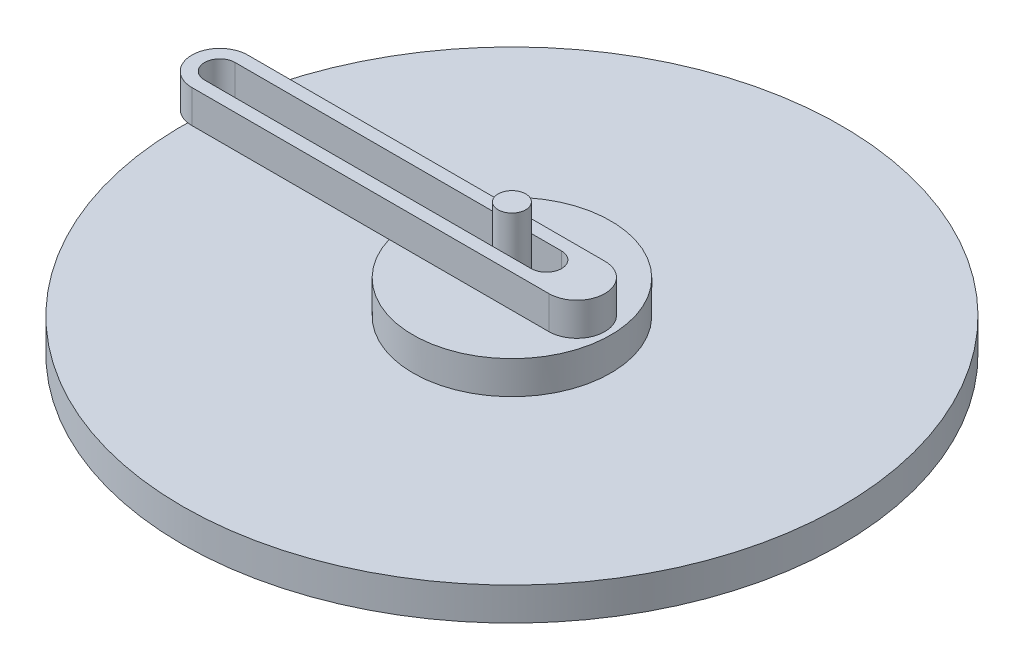
from build123d import *

# Parameters (mm, degrees)
SKETCH1_R           = 50
BOSS_EXTRUDE1_DEPTH = 5
SKETCH2_R           = 15
BOSS_EXTRUDE2_DEPTH = 5
BOSS_EXTRUDE3_DEPTH = 5
CUT_EXTRUDE1_DEPTH  = 5
SKETCH6_R           = 2.088892153
BOSS_EXTRUDE4_DEPTH = 10


with BuildPart() as part:
    # Sketch1 → Boss-Extrude1 (new body)
    with BuildSketch(Plane(origin=(0, 0, 0), x_dir=(1, 0, 0), z_dir=(0, 1, 0))):
        Circle(SKETCH1_R)
    extrude(amount=BOSS_EXTRUDE1_DEPTH)

    # Sketch2 → Boss-Extrude2 (add)
    with BuildSketch(Plane(origin=(0, 5, 0), x_dir=(1, 0, 0), z_dir=(0, 1, 0))):
        Circle(SKETCH2_R)
    extrude(amount=BOSS_EXTRUDE2_DEPTH)

    # Sketch4 → Boss-Extrude3 (add)
    with BuildSketch(Plane(origin=(0, 10, 0), x_dir=(1, 0, 0), z_dir=(0, 1, 0))):
        with BuildLine():
            Line((9.847634435, -4.252387597), (-44.314354955, -4.252387597))
            ThreePointArc((-44.314354955, -4.252387597), (-48.566742552, 0), (-44.314354955, 4.252387597))
            Line((-44.314354955, 4.252387597), (9.847634435, 4.252387597))
            ThreePointArc((9.847634435, 4.252387597), (14.100022031, 0), (9.847634435, -4.252387597))
        make_face()
    extrude(amount=BOSS_EXTRUDE3_DEPTH)

    # Sketch5 → Cut-Extrude1 (cut)
    with BuildSketch(Plane(origin=(0, 15, 0), x_dir=(1, 0, 0), z_dir=(0, 1, 0))):
        with BuildLine():
            Line((5.222230382, -2.312702026), (-44.314354955, -2.312702026))
            ThreePointArc((-44.314354955, -2.312702026), (-46.627056982, 0), (-44.314354955, 2.312702026))
            Line((-44.314354955, 2.312702026), (5.222230382, 2.312702026))
            ThreePointArc((5.222230382, 2.312702026), (7.534932408, 0), (5.222230382, -2.312702026))
        make_face()
    extrude(amount=-CUT_EXTRUDE1_DEPTH, mode=Mode.SUBTRACT)

    # Sketch6 → Boss-Extrude4 (add)
    with BuildSketch(Plane(origin=(0, 10, 0), x_dir=(1, 0, 0), z_dir=(0, 1, 0))):
        Circle(SKETCH6_R)
    extrude(amount=BOSS_EXTRUDE4_DEPTH)


solid = part.part
